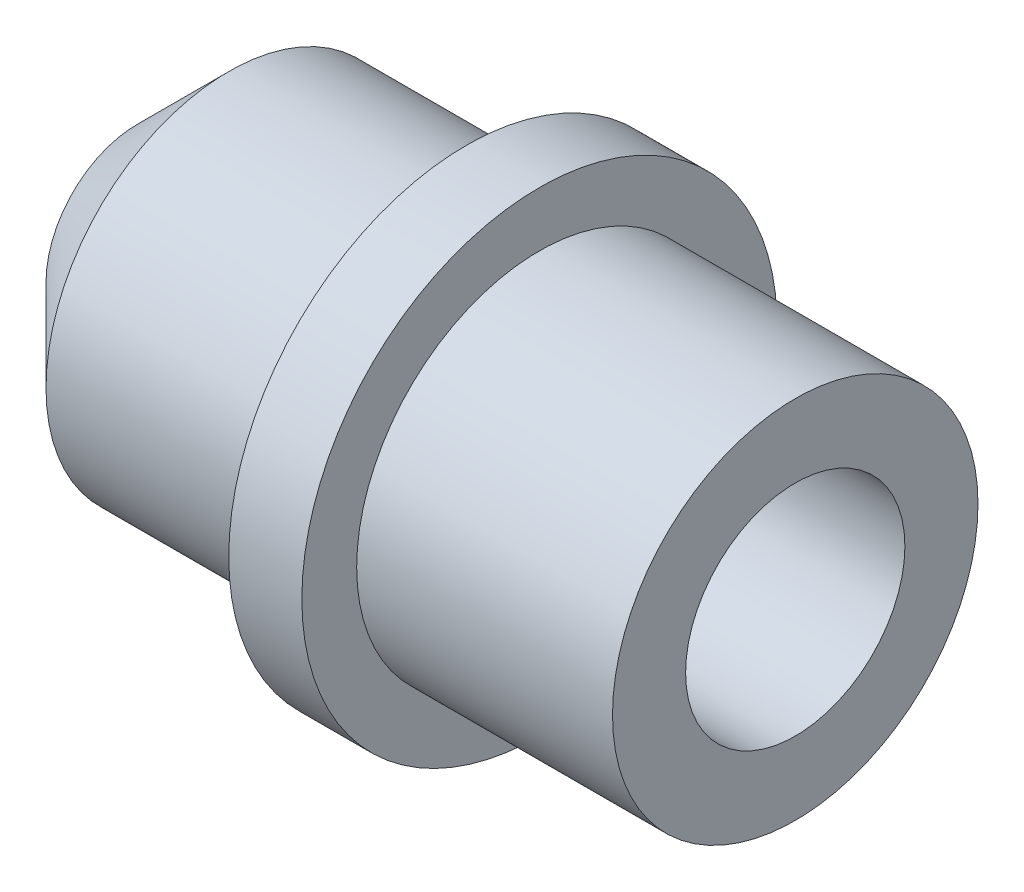
from build123d import *


with BuildPart() as part:
    # Эскиз1 → Повернуть1 (revolve)
    with BuildSketch(Plane(origin=(0, 0, 0), x_dir=(1, 0, 0), z_dir=(0, 1, 0))):
        Polygon((0.372553627, -3), (0.372553627, -5), (-6.627446373, -5), (-6.627446373, -6.5), (-8.627446373, -6.5), (-8.627446373, -5), (-15.127446373, -5), (-17.627446373, -2.5), (-17.627446373, -1.5), (-14.536630188, -1.5), (-14.536630188, -3), align=None)
    revolve(axis=Axis((-14.117647059, 0, 0), (1, 0, 0)))


solid = part.part
